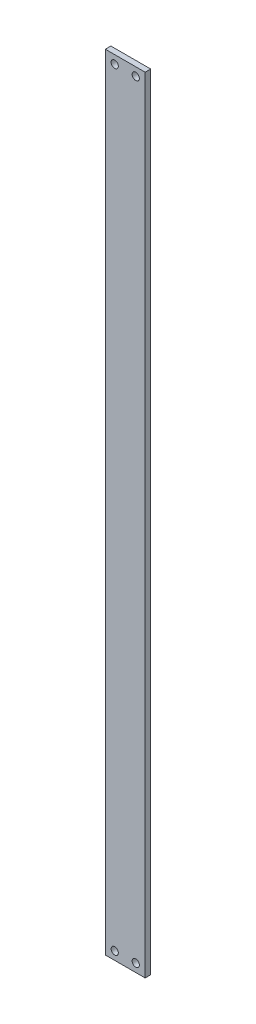
from build123d import *

# Parameters (mm, degrees)
SCHIZZO1_W                   = 36
SCHIZZO1_H                   = 709
SCHIZZO1_R                   = 3.25
ESTRUSIONE_ESTRUSIONE1_DEPTH = 5


with BuildPart() as part:
    # Schizzo1 → Estrusione-Estrusione1 (new body)
    with BuildSketch(Plane.XY.offset(5)):
        with Locations((-20.5, 157)):
            Rectangle(SCHIZZO1_W, SCHIZZO1_H)
        with Locations(Location((-30, -190, 0), (0, 0, 180))):
            Circle(SCHIZZO1_R, mode=Mode.SUBTRACT)
        with Locations(Location((-30, 504, 0), (0, 0, 180))):
            Circle(SCHIZZO1_R, mode=Mode.SUBTRACT)
        with Locations(Location((-11, 504, 0), (0, 0, 180))):
            Circle(SCHIZZO1_R, mode=Mode.SUBTRACT)
        with Locations(Location((-11, -190, 0), (0, 0, 180))):
            Circle(SCHIZZO1_R, mode=Mode.SUBTRACT)
    extrude(amount=-ESTRUSIONE_ESTRUSIONE1_DEPTH)


solid = part.part
